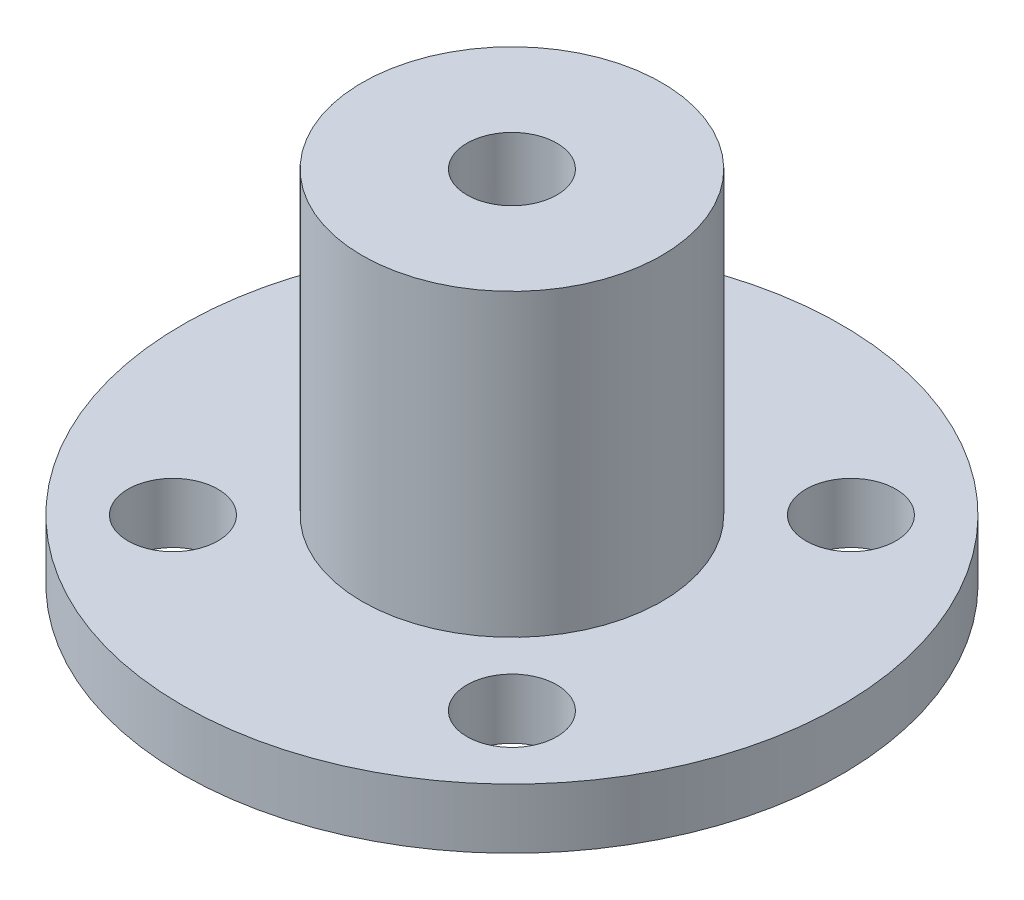
from build123d import *

# Parameters (mm, degrees)
SKETCH_1_R          = 11
SKETCH_1_R_2        = 1.5
EXTRUDE_1_DEPTH     = 2
SKETCH_2_R          = 5
SKETCH_2_R_2        = 1.5
EXTRUDE_2_DEPTH     = 10
SKETCH_3_R          = 1.5
CUT_EXTRUDE_1_DEPTH = 8


with BuildPart() as part:
    # 草图1 → 凸台-拉伸1 (new body)
    with BuildSketch(Plane(origin=(0, 0, 0), x_dir=(1, 0, 0), z_dir=(0, 1, 0))):
        with Locations(Location((0, 0, 0), (0, 0, 270))):
            Circle(SKETCH_1_R)
        with Locations(Location((0, 0, 0), (0, 0, 270))):
            Circle(SKETCH_1_R_2, mode=Mode.SUBTRACT)
        with Locations(Location((5.656854249, 5.656854249, 0), (0, 0, 270))):
            Circle(SKETCH_1_R_2, mode=Mode.SUBTRACT)
        with Locations(Location((-5.656854249, 5.656854249, 0), (0, 0, 270))):
            Circle(SKETCH_1_R_2, mode=Mode.SUBTRACT)
        with Locations(Location((-5.656854249, -5.656854249, 0), (0, 0, 270))):
            Circle(SKETCH_1_R_2, mode=Mode.SUBTRACT)
        with Locations(Location((5.656854249, -5.656854249, 0), (0, 0, 270))):
            Circle(SKETCH_1_R_2, mode=Mode.SUBTRACT)
    extrude(amount=EXTRUDE_1_DEPTH)

    # 草图2 → 凸台-拉伸2 (add)
    with BuildSketch(Plane(origin=(0, 2, 0), x_dir=(1, 0, 0), z_dir=(0, 1, 0))):
        with Locations(Location((0, 0, 0), (0, 0, 270))):
            Circle(SKETCH_2_R)
        with Locations(Location((0, 0, 0), (0, 0, 270))):
            Circle(SKETCH_2_R_2, mode=Mode.SUBTRACT)
    extrude(amount=EXTRUDE_2_DEPTH)

    # 草图3 → 切除-拉伸1 (cut)
    with BuildSketch(Plane.XY):
        with Locations((0, 8)):
            Circle(SKETCH_3_R)
    extrude(amount=-CUT_EXTRUDE_1_DEPTH, mode=Mode.SUBTRACT)


solid = part.part
